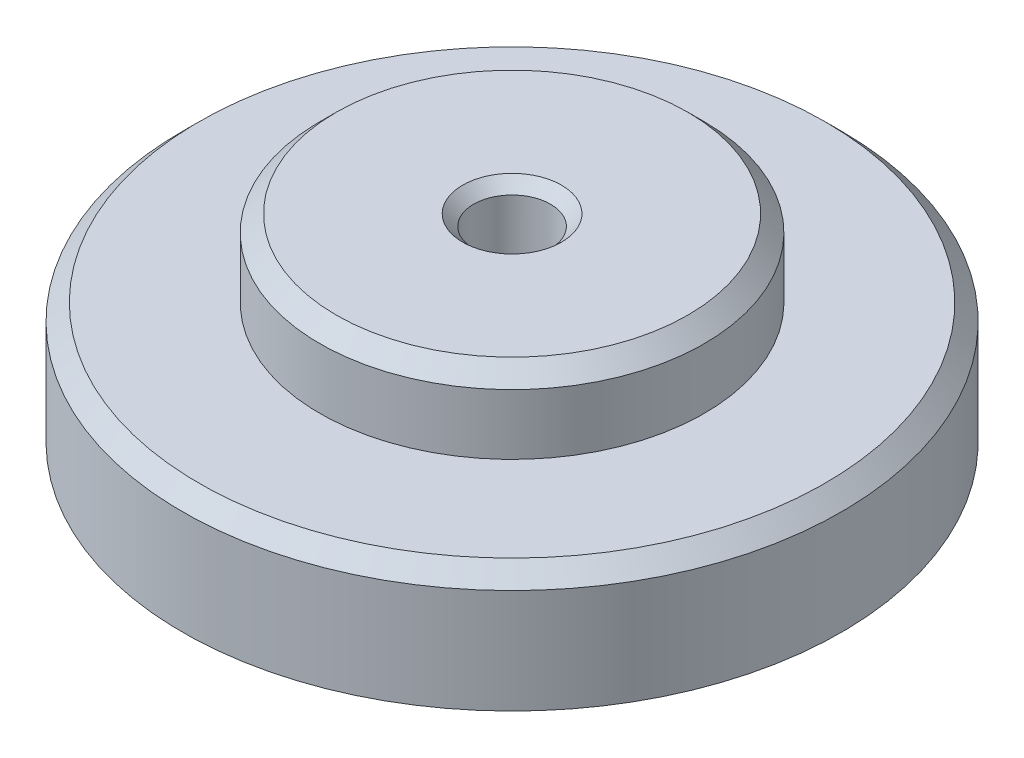
from build123d import *

# Parameters (mm, degrees)
M16_TAPPED_HOLE1_D     = 14
M16_TAPPED_HOLE1_DEPTH = 42
CHAMFER1_SIZE          = 2


with BuildPart() as part:
    # Sketch1 → Revolve1 (revolve)
    with BuildSketch(Plane.XY, mode=Mode.PRIVATE) as revolve1_sk:
        Polygon((0, 36), (0, 11), (45, 11), (45, 0), (60, 0), (60, 19), (57, 22), (35, 22), (35, 33), (32, 36), align=None)
    revolve(revolve1_sk.sketch.rotate(Axis((0, 0, 0), (0, 1, 0)), 90), axis=Axis((0, 0, 0), (0, 1, 0)))

    # M16 Tapped Hole1
    with Locations(Plane(origin=(0, 36, 0), x_dir=(1, 0, 0), z_dir=(0, 1, 0))):
        with Locations((0, 0)):
            Hole(M16_TAPPED_HOLE1_D / 2, depth=M16_TAPPED_HOLE1_DEPTH)

    # Chamfer1
    chamfer1_edges = [part.edges().sort_by_distance(p)[0] for p in [
        (7, 36, 0),
    ]]
    chamfer(chamfer1_edges, length=CHAMFER1_SIZE)


solid = part.part
